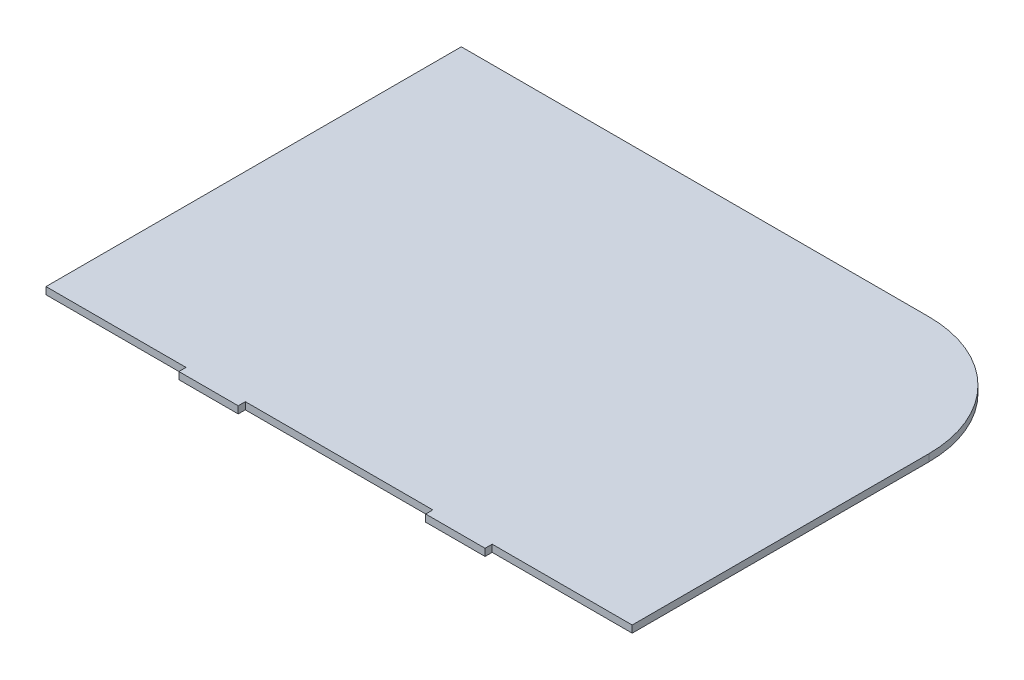
from build123d import *

# Parameters (mm, degrees)
BOSS_EXTRUDE1_DEPTH = 6


with BuildPart() as part:
    # Sketch1 → Boss-Extrude1 (new body)
    with BuildSketch(Plane(origin=(0, 0, 0), x_dir=(1, 0, 0), z_dir=(0, 1, 0))):
        with BuildLine():
            Line((54.064062015, -230.864850181), (54.064062015, -236.864850181))
            Line((54.064062015, -236.864850181), (104.064062015, -236.864850181))
            Line((104.064062015, -236.864850181), (104.064062015, -230.864850181))
            Line((104.064062015, -230.864850181), (222.064062015, -230.864850181))
            Line((222.064062015, -230.864850181), (222.064062015, 19.135149819))
            ThreePointArc((222.064062015, 19.135149819), (192.774740133, 89.845827938), (122.064062015, 119.135149819))
            Line((122.064062015, 119.135149819), (-271.935937985, 119.135149819))
            Line((-271.935937985, 119.135149819), (-271.935937985, -230.864850181))
            Line((-271.935937985, -230.864850181), (-153.935937985, -230.864850181))
            Line((-153.935937985, -230.864850181), (-153.935937985, -236.864850181))
            Line((-153.935937985, -236.864850181), (-103.935937985, -236.864850181))
            Line((-103.935937985, -236.864850181), (-103.935937985, -230.864850181))
            Line((-103.935937985, -230.864850181), (54.064062015, -230.864850181))
        make_face()
    extrude(amount=BOSS_EXTRUDE1_DEPTH)


solid = part.part
